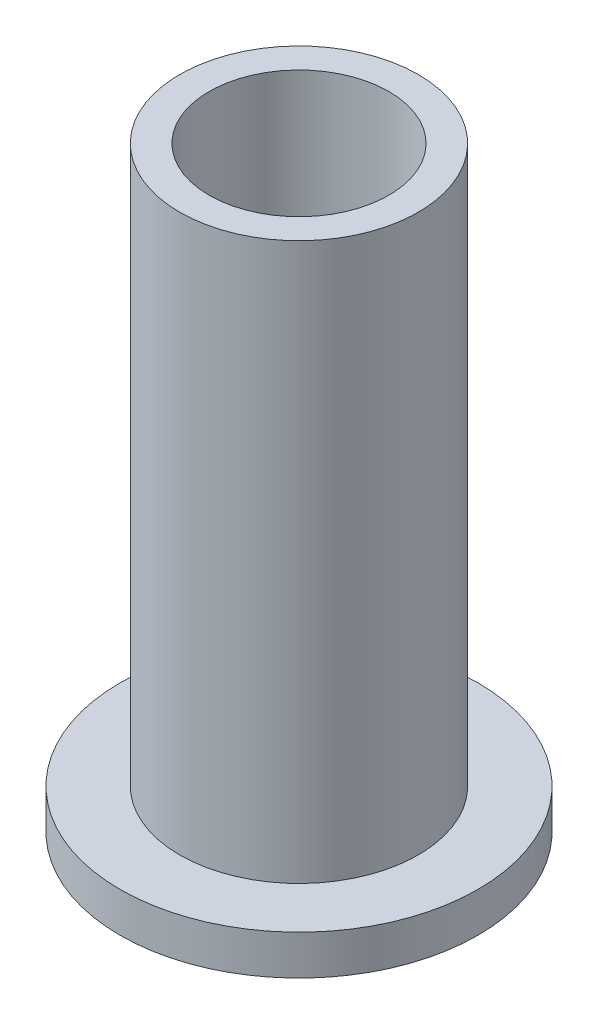
from build123d import *

# Parameters (mm, degrees)
SKETCH1_R           = 5.999947903
SKETCH1_R_2         = 4.521109164
BOSS_EXTRUDE1_DEPTH = 30
SKETCH3_R           = 8.999947903
SKETCH3_R_2         = 5.999947903
BOSS_EXTRUDE2_DEPTH = 2


with BuildPart() as part:
    # Sketch1 → Boss-Extrude1 (new body)
    with BuildSketch(Plane(origin=(0, 0, 0), x_dir=(1, 0, 0), z_dir=(0, 1, 0))):
        with Locations(Location((0, -1.370857001, 0), (0, 0, 270))):
            Circle(SKETCH1_R)
        with Locations(Location((0, -1.370857001, 0), (0, 0, 270))):
            Circle(SKETCH1_R_2, mode=Mode.SUBTRACT)
    extrude(amount=BOSS_EXTRUDE1_DEPTH)

    # Sketch3 → Boss-Extrude2 (add)
    with BuildSketch(Plane.XZ):
        with Locations(Location((0, 1.370857001, 0), (0, 0, 270))):
            Circle(SKETCH3_R)
        with Locations(Location((0, 1.370857001, 0), (0, 0, 270))):
            Circle(SKETCH3_R_2, mode=Mode.SUBTRACT)
    extrude(amount=-BOSS_EXTRUDE2_DEPTH)


solid = part.part
